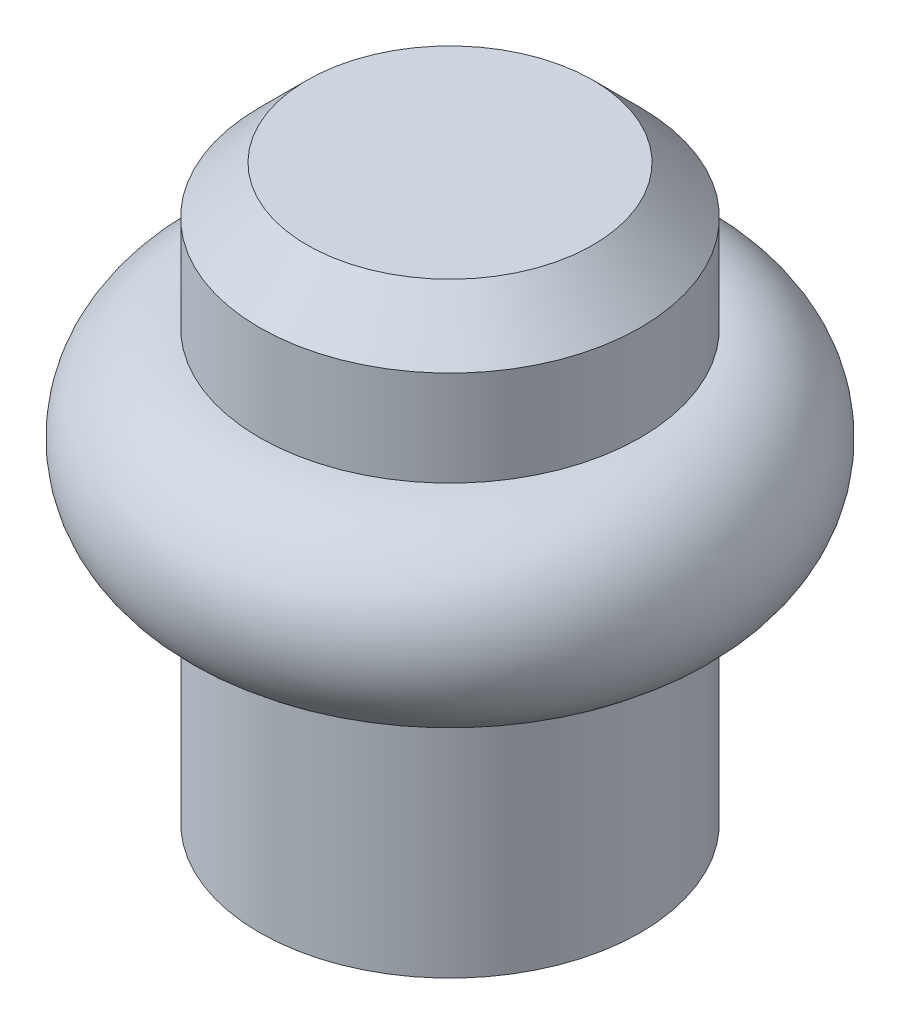
from build123d import *


with BuildPart() as part:
    # Sketch1 → Revolve1 (revolve)
    with BuildSketch(Plane(origin=(0, 0, 0), x_dir=(0, 0, -1), z_dir=(1, 0, 0)), mode=Mode.PRIVATE) as revolve1_sk:
        with BuildLine():
            Line((0, 0), (0, 3))
            Line((0, 3), (-0.75, 3))
            Line((-0.75, 3), (-1, 2.75))
            Line((-1, 2.75), (-1, 2.25))
            ThreePointArc((-1, 2.25), (-1.5, 1.75), (-1, 1.25))
            Line((-1, 1.25), (-1, 0))
            Line((-1, 0), (0, 0))
        make_face()
    revolve(revolve1_sk.sketch.rotate(Axis((0, 0, 0), (0, 1, 0)), 180), axis=Axis((0, 0, 0), (0, 1, 0)))


solid = part.part
